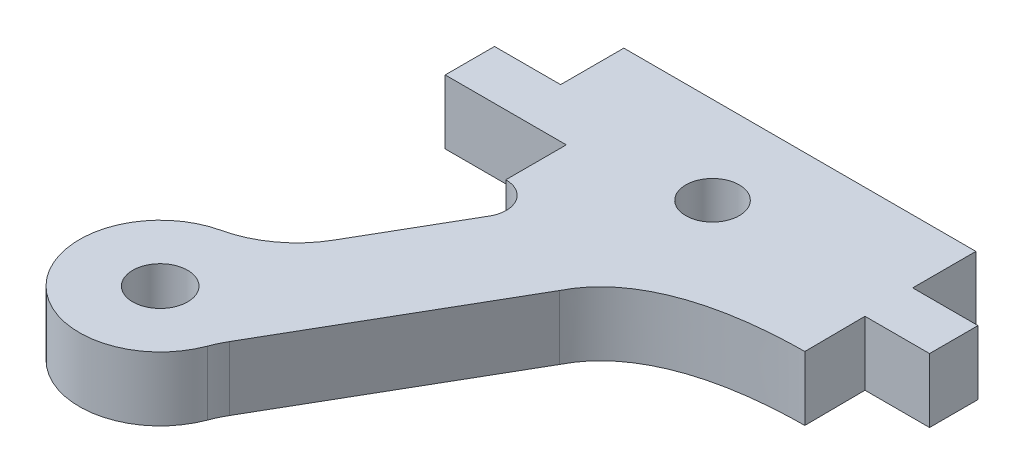
from build123d import *

# Parameters (mm, degrees)
SKETCH1_R           = 1.36
SKETCH1_R_2         = 1.3250121
BOSS_EXTRUDE1_DEPTH = 3.175


with BuildPart() as part:
    # Sketch1 → Boss-Extrude1 (new body)
    with BuildSketch(Plane(origin=(0, 0, 0), x_dir=(1, 0, 0), z_dir=(0, 1, 0))):
        with BuildLine():
            Line((112.722877294, 126.593302228), (112.72277638, 123.593222295))
            ThreePointArc((112.72277638, 123.593222295), (113.875226377, 122.941979767), (113.863024117, 121.61830725))
            Line((113.863024117, 121.61830725), (111.050643934, 116.74721322))
            ThreePointArc((111.050643934, 116.74721322), (109.689478532, 115.224141686), (107.832794667, 114.372529579))
            ThreePointArc((107.832794667, 114.372529579), (105.709889346, 107.841486649), (112.467185669, 109.066311194))
            ThreePointArc((112.467185669, 109.066311194), (112.627253492, 109.444515831), (112.817819601, 109.808308371))
            Line((112.817819601, 109.808308371), (118.803678696, 120.175836459))
            add(Edge.make_bspline(
                [(118.803678696, 120.175836459), (120.361778696, 123.269636459), (125.055778696, 123.618636459), (127.497578696, 123.636436459)],
                knots=[0.666666667, 0.666666667, 0.666666667, 0.666666667, 0.708333333, 0.708333333, 0.708333333, 0.708333333], degree=3))
            Line((127.497578696, 123.636436459), (127.475978696, 126.636436459))
            Line((127.475978696, 126.636436459), (130.675779856, 126.636436459))
            Line((130.675779856, 126.636436459), (130.675779856, 129.036436459))
            Line((130.675779856, 129.036436459), (127.440025111, 129.036436459))
            Line((127.440025111, 129.036436459), (127.440025111, 132.168236459))
            Line((127.440025111, 132.168236459), (109.997615958, 132.168236459))
            Line((109.997615958, 132.168236459), (109.997615958, 129.036436459))
            Line((109.997615958, 129.036436459), (106.722915958, 129.036436459))
            Line((106.722915958, 129.036436459), (106.722915958, 126.593302228))
            Line((106.722915958, 126.593302228), (112.722877294, 126.593302228))
        make_face()
        with Locations(Location((108.72260063, 110.472754541, 0), (0, 0, 270))):
            Circle(SKETCH1_R, mode=Mode.SUBTRACT)
        with Locations(Location((118.723210584, 127.836436459, 0), (0, 0, 270))):
            Circle(SKETCH1_R_2, mode=Mode.SUBTRACT)
    extrude(amount=BOSS_EXTRUDE1_DEPTH)


solid = part.part
